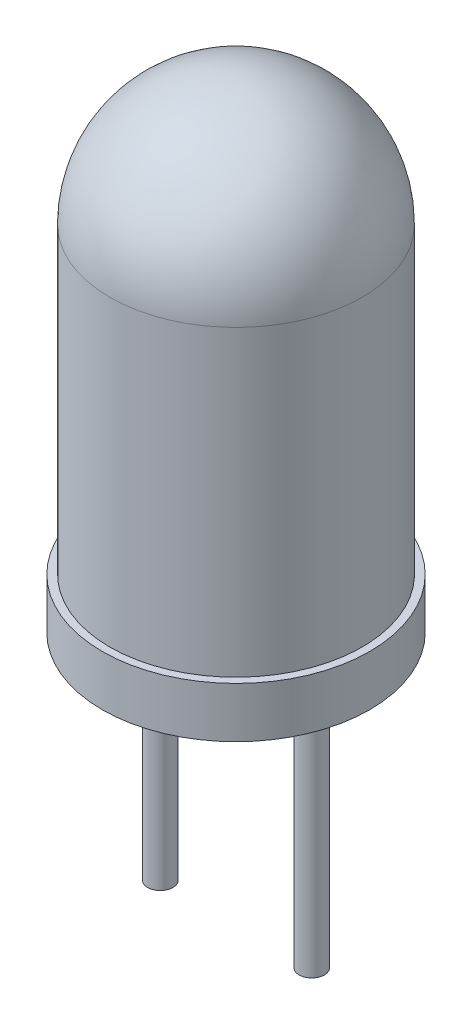
from build123d import *

# Parameters (mm, degrees)
SKETCH2_R           = 0.25
BOSS_EXTRUDE1_DEPTH = 5


with BuildPart() as part:
    # Sketch1 → Revolve1 (revolve)
    with BuildSketch(Plane(origin=(0, 0, 0), x_dir=(0, 0, -1), z_dir=(1, 0, 0))):
        with BuildLine():
            Line((-2.5, -0.431829007), (-2.5, 5.568170993))
            ThreePointArc((-2.5, 5.568170993), (-1.767766953, 7.335937946), (0, 8.068170993))
            Line((0, 8.068170993), (0, 1.631287774))
            Line((0, 1.631287774), (0, -1.431829007))
            Line((0, -1.431829007), (-2.65, -1.431829007))
            Line((-2.65, -1.431829007), (-2.65, -0.431829007))
            Line((-2.65, -0.431829007), (-2.5, -0.431829007))
        make_face()
    revolve(axis=Axis((0, 8.068170993, 0), (0, -1, 0)))

    # Sketch2 → Boss-Extrude1 (add)
    with BuildSketch(Plane.XZ.offset(1.431829007)):
        with Locations(Location((-1.5, 0, 0), (0, 0, 270))):
            Circle(SKETCH2_R)
        with Locations(Location((1.5, 0, 0), (0, 0, 90))):
            Circle(SKETCH2_R)
    extrude(amount=BOSS_EXTRUDE1_DEPTH)


solid = part.part
